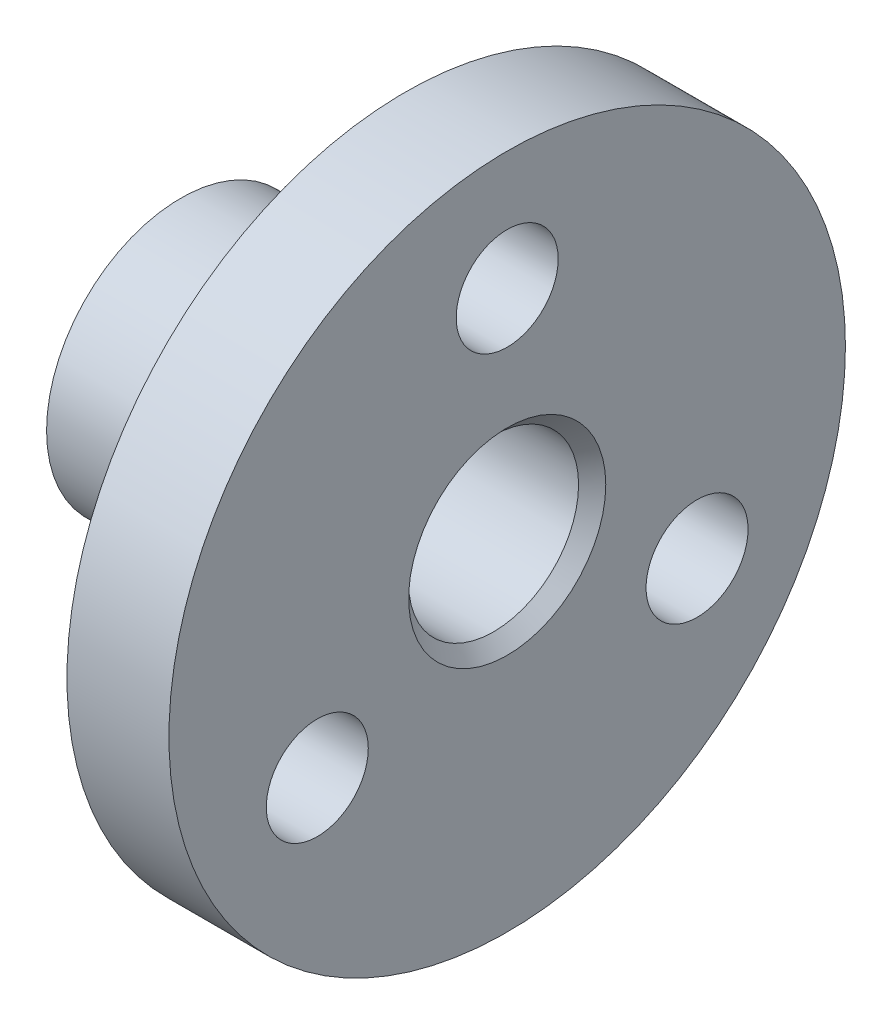
from build123d import *

# Parameters (mm, degrees)
SKETCH_1_R               = 9.95
SKETCH_1_R_2             = 1.5
EXTRUDE_1_DEPTH          = 3
SKETCH_2_R               = 3.95
EXTRUDE_2_DEPTH          = 6.6
CUT_EXTRUDE_1_DEPTH      = 18.034230244
CUT_EXTRUDE_1_DEPTH_BACK = 18.034230244
SKETCH_3_R               = 2.5
CHAMFER_1_SIZE           = 0.4


with BuildPart() as part:
    # Эскиз1 → Бобышка-Вытянуть1 (new body)
    with BuildSketch(Plane(origin=(0, 0, 0), x_dir=(0, 0, -1), z_dir=(1, 0, 0))):
        Circle(SKETCH_1_R)
        with Locations((0, 6.45)):
            Circle(SKETCH_1_R_2, mode=Mode.SUBTRACT)
        with Locations((5.585863854, -3.225)):
            Circle(SKETCH_1_R_2, mode=Mode.SUBTRACT)
        with Locations((-5.585863854, -3.225)):
            Circle(SKETCH_1_R_2, mode=Mode.SUBTRACT)
    extrude(amount=EXTRUDE_1_DEPTH)

    # Эскиз2 → Бобышка-Вытянуть2 (add)
    with BuildSketch(Plane.ZY):
        with Locations(Location((0, 0, 0), (0, 0, 180))):
            Circle(SKETCH_2_R)
    extrude(amount=EXTRUDE_2_DEPTH)

    # Эскиз3 → Вырез-Вытянуть1 (cut, two sides: drawn at the far end of the back side and taken through both)
    with BuildSketch(Plane.ZY.offset(6.6).offset(-CUT_EXTRUDE_1_DEPTH_BACK)):
        Circle(SKETCH_3_R)
    extrude(amount=CUT_EXTRUDE_1_DEPTH + CUT_EXTRUDE_1_DEPTH_BACK, mode=Mode.SUBTRACT)

    # Фаска1
    chamfer_1_edges = [part.edges().sort_by_distance(p)[0] for p in [
        (-6.6, 0, -2.5),
        (3, 0, -2.5),
    ]]
    chamfer(chamfer_1_edges, length=CHAMFER_1_SIZE)


solid = part.part
